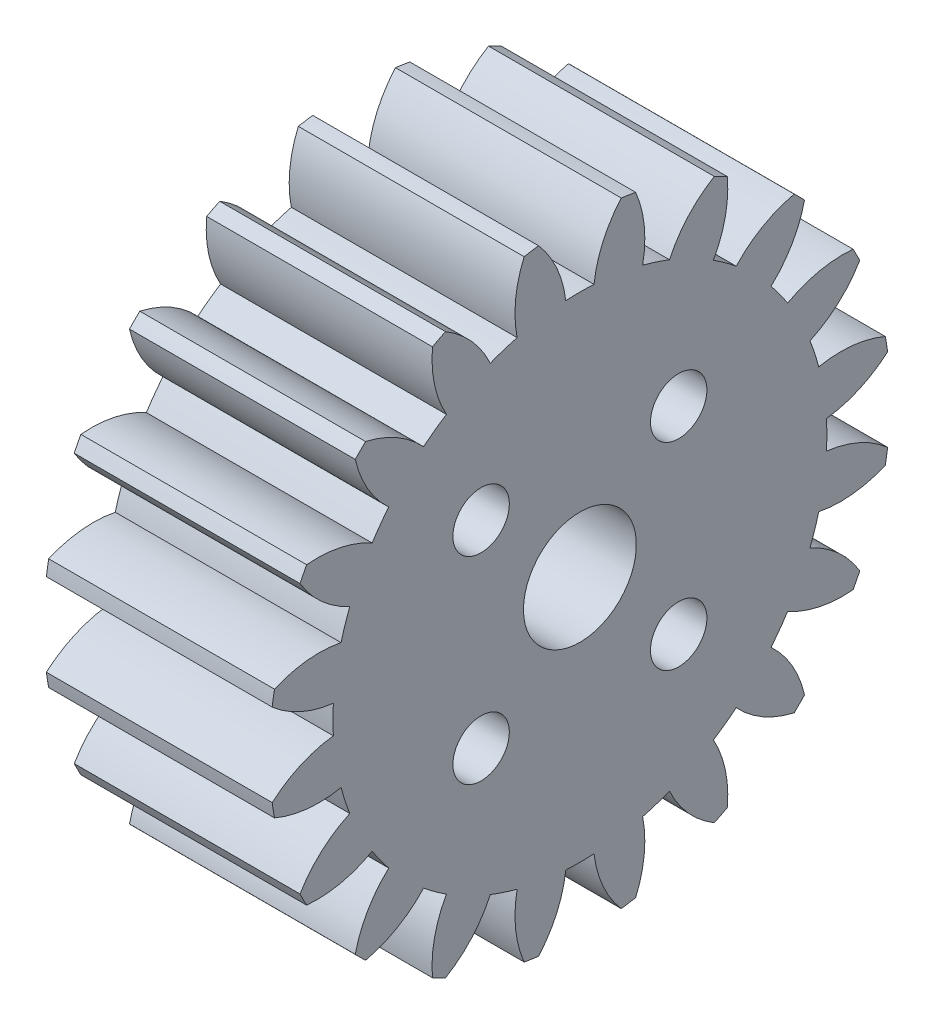
from build123d import *

# Parameters (mm, degrees)
BASPROSKE_W             = 8
BASPROSKE_H             = 11
TOOTHCUT_DEPTH          = 18.492855685
TEETHCUTS_COUNT         = 20
TEETHCUTS_ANGLE         = 342
BORSKE_R                = 2
BORE_DEPTH              = 50.0000508
CUT_EXTRUDE1_DEPTH      = 6
CUT_EXTRUDE1_DEPTH_BACK = 13


with BuildPart() as part:
    # BasProSke → Base-Revolve (revolve)
    with BuildSketch(Plane(origin=(0, 0, 0), x_dir=(1, 0, 0), z_dir=(0, 1, 0)), mode=Mode.PRIVATE) as base_revolve_sk:
        with Locations((4, 5.5)):
            Rectangle(BASPROSKE_W, BASPROSKE_H)
    revolve(base_revolve_sk.sketch.rotate(Axis((-10, 0, 0), (1, 0, 0)), 180), axis=Axis((-10, 0, 0), (1, 0, 0)))

    # TooCutSke → ToothCut (cut, through all)
    with BuildSketch(Plane(origin=(0, 0, 0), x_dir=(0, 0, -1), z_dir=(1, 0, 0))):
        with BuildLine():
            ThreePointArc((0.499924007, 8.734705318), (0, 8.749), (-0.499924007, 8.734705318))
            ThreePointArc((-0.499924007, 8.734705318), (-0.824302243, 9.905497836), (-1.485192705, 10.924909509))
            ThreePointArc((-1.485192705, 10.924909509), (0, 11.0254), (1.485192705, 10.924909509))
            ThreePointArc((1.485192705, 10.924909509), (0.824302243, 9.905497836), (0.499924007, 8.734705318))
        make_face()
    toothcut = extrude(amount=TOOTHCUT_DEPTH, mode=Mode.SUBTRACT)

    # TeethCuts: ToothCut ×20 about axis
    teethcuts_axis = Axis((-10, 0, 0), (1, 0, 0))
    for i in range(1, TEETHCUTS_COUNT):
        add(toothcut.rotate(teethcuts_axis, i * TEETHCUTS_ANGLE / (TEETHCUTS_COUNT - 1)), mode=Mode.SUBTRACT)

    # BorSke → Bore (cut, symmetric)
    with BuildSketch(Plane(origin=(0, 0, 0), x_dir=(0, 0, -1), z_dir=(1, 0, 0))):
        with Locations(Location((0, 0, 0), (0, 0, 180))):
            Circle(BORSKE_R)
    extrude(amount=BORE_DEPTH, both=True, mode=Mode.SUBTRACT)

    # Sketch1 → Cut-Extrude1 (cut, two sides: drawn at the far end of the back side and taken through both)
    with BuildSketch(Plane(origin=(8, 0, 0), x_dir=(0, 0, -1), z_dir=(1, 0, 0)).offset(-CUT_EXTRUDE1_DEPTH_BACK)):
        with BuildLine():
            ThreePointArc((-2.5, -3.5), (-3.5, -2.5), (-4.5, -3.5))
            Line((-4.5, -3.5), (-2.5, -3.5))
        make_face()
        with BuildLine():
            Line((-2.5, -3.5), (-4.5, -3.5))
            ThreePointArc((-4.5, -3.5), (-4.207106781, -4.207106781), (-3.5, -4.5))
            ThreePointArc((-3.5, -4.5), (-2.792893219, -4.207106781), (-2.5, -3.5))
        make_face()
        with BuildLine():
            ThreePointArc((-3.499999992, 4.5), (-4.207106778, 4.207106784), (-4.5, 3.5))
            Line((-4.5, 3.5), (-2.5, 3.5))
            ThreePointArc((-2.5, 3.5), (-2.792893216, 4.207106778), (-3.499999992, 4.5))
        make_face()
        with BuildLine():
            Line((-2.5, 3.5), (-4.5, 3.5))
            ThreePointArc((-4.5, 3.5), (-4.207106779, 2.792893217), (-3.499999995, 2.5))
            ThreePointArc((-3.499999995, 2.5), (-2.792893217, 2.792893221), (-2.5, 3.5))
        make_face()
        with BuildLine():
            ThreePointArc((3.5, 2.5), (4.207106781, 2.792893219), (4.5, 3.5))
            Line((4.5, 3.5), (2.5, 3.5))
            ThreePointArc((2.5, 3.5), (2.792893219, 2.792893219), (3.5, 2.5))
        make_face()
        with BuildLine():
            Line((2.5, 3.5), (4.5, 3.5))
            ThreePointArc((4.5, 3.5), (4.207106781, 4.207106781), (3.5, 4.5))
            ThreePointArc((3.5, 4.5), (2.792893219, 4.207106781), (2.5, 3.5))
        make_face()
        with BuildLine():
            ThreePointArc((3.5, -4.5), (4.207106781, -4.207106781), (4.5, -3.5))
            Line((4.5, -3.5), (2.5, -3.5))
            ThreePointArc((2.5, -3.5), (2.792893219, -4.207106781), (3.5, -4.5))
        make_face()
        with BuildLine():
            Line((2.5, -3.5), (4.5, -3.5))
            ThreePointArc((4.5, -3.5), (4.207106781, -2.792893219), (3.5, -2.5))
            ThreePointArc((3.5, -2.5), (2.792893219, -2.792893219), (2.5, -3.5))
        make_face()
    extrude(amount=CUT_EXTRUDE1_DEPTH + CUT_EXTRUDE1_DEPTH_BACK, mode=Mode.SUBTRACT)


solid = part.part
